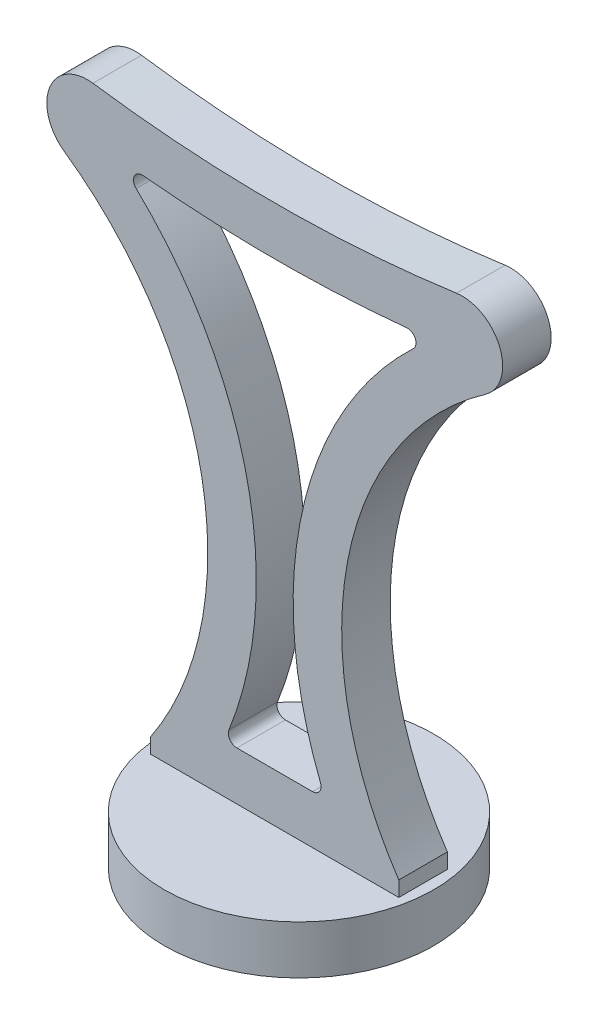
from build123d import *

# Parameters (mm, degrees)
SKETCH2_R               = 50
BOSS_EXTRUDE1_DEPTH     = 18
BOSS_EXTRUDE2_DEPTH     = 9
CUT_EXTRUDE1_DEPTH      = 246.555378534
CUT_EXTRUDE2_DEPTH      = 228.193000482
CUT_EXTRUDE2_DEPTH_BACK = 228.193000482
SKETCH5_W               = 30
SKETCH5_H               = 18
CHAMFER1_SIZE           = 4
SKETCH6_R               = 1.5875
CUT_EXTRUDE3_DEPTH      = 18


with BuildPart() as part:
    # Sketch2 → Boss-Extrude1 (new body)
    with BuildSketch(Plane(origin=(0, 0, 0), x_dir=(1, 0, 0), z_dir=(0, 1, 0))):
        with Locations(Location((0, 0, 0), (0, 0, 270))):
            Circle(SKETCH2_R)
    extrude(amount=BOSS_EXTRUDE1_DEPTH)

    # Sketch5 → Cut-Extrude2 (cut, two sides: drawn at the far end of the back side and taken through both)
    with BuildSketch(Plane(origin=(0, 18, 0), x_dir=(1, 0, 0), z_dir=(0, 1, 0)).offset(-CUT_EXTRUDE2_DEPTH_BACK)):
        Rectangle(SKETCH5_W, SKETCH5_H)
    extrude(amount=CUT_EXTRUDE2_DEPTH + CUT_EXTRUDE2_DEPTH_BACK, mode=Mode.SUBTRACT)

    # Chamfer1
    chamfer1_edges = [part.edges().sort_by_distance(p)[0] for p in [
        (15, 18, 0),
        (-15, 18, 0),
    ]]
    chamfer(chamfer1_edges, length=CHAMFER1_SIZE)

    # Sketch6 → Cut-Extrude3 (cut)
    with BuildSketch(Plane.XZ):
        with Locations((-15, 7.4125)):
            Circle(SKETCH6_R)
        with Locations((-15, -7.4125)):
            Circle(SKETCH6_R)
        with Locations((15, 7.4125)):
            Circle(SKETCH6_R)
        with Locations((15, -7.4125)):
            Circle(SKETCH6_R)
    extrude(amount=-CUT_EXTRUDE3_DEPTH, mode=Mode.SUBTRACT)


with BuildPart() as body_2:
    # Sketch3 → Boss-Extrude2 (new, symmetric)
    with BuildSketch(Plane.XY):
        with BuildLine():
            Line((-15, 14.825), (-15, 0))
            Line((-15, 0), (15, 0))
            Line((15, 0), (15, 14.825))
            ThreePointArc((15, 14.825), (15.92993597, 17.07006403), (18.175, 18))
            Line((18.175, 18), (46, 18))
            Line((46, 18), (46, 23.625028594))
            ThreePointArc((46, 23.625028594), (26.95349395, 116.163705067), (78.103728943, 195.598140272))
            ThreePointArc((78.103728943, 195.598140272), (83.450113872, 213.387105329), (67.399006159, 222.735530373))
            ThreePointArc((67.399006159, 222.735530373), (0, 218), (-67.399006159, 222.735530373))
            ThreePointArc((-67.399006159, 222.735530373), (-83.450113872, 213.387105329), (-78.103728943, 195.598140272))
            ThreePointArc((-78.103728943, 195.598140272), (-26.95349395, 116.163705067), (-46, 23.625028594))
            Line((-46, 23.625028594), (-46, 18))
            Line((-46, 18), (-18.175, 18))
            ThreePointArc((-18.175, 18), (-15.92993597, 17.07006403), (-15, 14.825))
        make_face()
    extrude(amount=BOSS_EXTRUDE2_DEPTH, both=True)

    # Sketch4 → Cut-Extrude1 (cut, through all)
    with BuildSketch(Plane.XY.offset(9)):
        with BuildLine():
            Line((-14.015756856, 36), (14.015756856, 36))
            ThreePointArc((14.015756856, 36), (16.643309774, 37.392700737), (16.965732055, 40.348998009))
            ThreePointArc((16.965732055, 40.348998009), (10.163023785, 123.915915071), (51.373576105, 196.932329968))
            ThreePointArc((51.373576105, 196.932329968), (52.075271601, 200.554653383), (48.877181189, 202.394713494))
            ThreePointArc((48.877181189, 202.394713494), (0, 200), (-48.877181189, 202.394713494))
            ThreePointArc((-48.877181189, 202.394713494), (-52.075271601, 200.554653383), (-51.373576105, 196.932329968))
            ThreePointArc((-51.373576105, 196.932329968), (-10.163023785, 123.915915071), (-16.965732055, 40.348998009))
            ThreePointArc((-16.965732055, 40.348998009), (-16.643309774, 37.392700737), (-14.015756856, 36))
        make_face()
    extrude(amount=-CUT_EXTRUDE1_DEPTH, mode=Mode.SUBTRACT)


solid = Compound([part.part, body_2.part])
